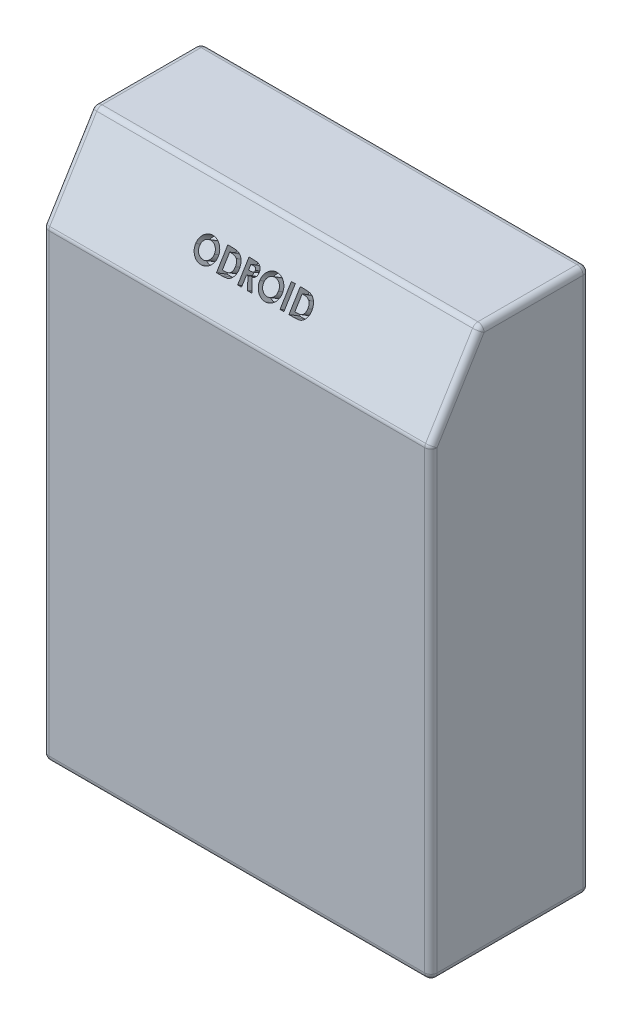
from build123d import *

# Parameters (mm, degrees)
SKETCH1_W           = 62.5
SKETCH1_H           = 87.5
BOSS_EXTRUDE1_DEPTH = 25.5
CUT_EXTRUDE1_DEPTH  = 65.5
FILLET1_R           = 1
SKETCH3_W           = 0.628205128
SKETCH3_H           = 3.5
CUT_EXTRUDE2_DEPTH  = 2


with BuildPart() as part:
    # Sketch1 → Boss-Extrude1 (new body)
    with BuildSketch(Plane.XY):
        Rectangle(SKETCH1_W, SKETCH1_H)
    extrude(amount=BOSS_EXTRUDE1_DEPTH)

    # Sketch2 → Cut-Extrude1 (cut)
    with BuildSketch(Plane(origin=(31.25, 0, 0), x_dir=(0, 0, -1), z_dir=(1, 0, 0))):
        Polygon((-25.5, 43.75), (-17.5, 43.75), (-25.5, 30.75), align=None)
    extrude(amount=-CUT_EXTRUDE1_DEPTH, mode=Mode.SUBTRACT)

    # Fillet1
    fillet1_edges = [part.edges().sort_by_distance(p)[0] for p in [
        (0, -43.75, 25.5),
        (-31.25, -6.5, 25.5),
        (0, 30.75, 25.5),
        (-31.25, 43.75, 8.75),
        (31.25, 43.75, 8.75),
        (-31.25, 37.25, 21.5),
        (0, 43.75, 17.5),
        (31.25, 37.25, 21.5),
        (31.25, -6.5, 25.5),
        (0, -43.75, 0),
        (-31.25, 0, 0),
        (0, 43.75, 0),
        (31.25, 0, 0),
        (31.25, -43.75, 12.75),
        (-31.25, -43.75, 12.75),
    ]]
    fillet(fillet1_edges, radius=FILLET1_R)

    # Sketch3 → Cut-Extrude2 (cut)
    # profile 1 of 6: a face of its own
    with BuildSketch(Plane(origin=(0, 19.82832618, 32.221030043), x_dir=(1, 0, 0), z_dir=(0, 0.5240974256643348, 0.8516583167045438))):
        with BuildLine():
            add(Edge.make_bspline(
                [(-8.513583921, 21.75241855), (-8.452732132, 21.750842988), (-8.332596917, 21.747732473), (-8.155921368, 21.721803895), (-7.985661809, 21.679556996), (-7.821895232, 21.62083075), (-7.665031688, 21.544034552), (-7.514517868, 21.451345625), (-7.370892905, 21.341014522), (-7.235628553, 21.215615084), (-7.110619896, 21.07924867), (-7.002299822, 20.932425982), (-6.909928436, 20.778951342), (-6.833370785, 20.618413512), (-6.775057883, 20.449700689), (-6.734137308, 20.273673087), (-6.707847866, 20.090380783), (-6.704824176, 19.965583707), (-6.703287447, 19.902158134)],
                knots=[0, 0, 0, 0, 1.014329547, 2.002516266, 2.970391464, 3.935626869, 4.897733899, 5.877609409, 6.878433252, 7.912639331, 8.949961323, 9.958554974, 10.949718813, 11.932905612, 12.9188844, 13.919928257, 14.942845884, 16, 16, 16, 16], degree=3))
            add(Edge.make_bspline(
                [(-6.703287447, 19.902158134), (-6.704923997, 19.83944722), (-6.708148871, 19.715873353), (-6.733064058, 19.53427016), (-6.774673741, 19.36012818), (-6.831997609, 19.193053239), (-6.907166795, 19.03385459), (-6.997736838, 18.881515772), (-7.10609771, 18.737450527), (-7.228297064, 18.601736164), (-7.362827949, 18.478546259), (-7.505317512, 18.369985367), (-7.655107825, 18.277994965), (-7.811979643, 18.202617187), (-7.976269369, 18.14411927), (-8.147571189, 18.102844739), (-8.325874501, 18.077761373), (-8.447129401, 18.074557563), (-8.508676069, 18.072931371)],
                knots=[0, 0, 0, 0, 1.051557043, 2.072126891, 3.067553643, 4.050577992, 5.02905126, 6.015227836, 7.017913613, 8.04756643, 9.074058332, 10.072836633, 11.047628519, 12.017157415, 12.98668631, 13.966869689, 14.968021931, 16, 16, 16, 16], degree=3))
            add(Edge.make_bspline(
                [(-8.508676069, 18.072931371), (-8.573046504, 18.074390146), (-8.699525611, 18.077256439), (-8.88462835, 18.104513578), (-9.061972768, 18.145572351), (-9.230069069, 18.206850368), (-9.390629173, 18.283453042), (-9.542473394, 18.377793827), (-9.685550706, 18.489716818), (-9.819040391, 18.616355626), (-9.93998237, 18.754926258), (-10.046737389, 18.901313843), (-10.136787615, 19.054400107), (-10.210136344, 19.2142567), (-10.267961536, 19.37989015), (-10.308750638, 19.552309213), (-10.332845734, 19.731100366), (-10.336202041, 19.852538891), (-10.337902832, 19.914077204)],
                knots=[0, 0, 0, 0, 1.067978421, 2.098431617, 3.099715153, 4.085208694, 5.062210972, 6.048429807, 7.046490867, 8.072918869, 9.098532598, 10.095778865, 11.076610158, 12.041847152, 13.011192615, 13.984257998, 14.978533688, 16, 16, 16, 16], degree=3))
            add(Edge.make_bspline(
                [(-10.337902832, 19.914077204), (-10.337369026, 19.95547696), (-10.336308173, 20.037752255), (-10.323529084, 20.159680042), (-10.30513087, 20.279227963), (-10.277920784, 20.395919378), (-10.244867484, 20.510577491), (-10.202042266, 20.622135035), (-10.153295577, 20.731783752), (-10.096339661, 20.838228553), (-10.03301019, 20.940490058), (-9.963912099, 21.03808588), (-9.888871641, 21.129835944), (-9.808130546, 21.216343193), (-9.721410571, 21.297039009), (-9.629852426, 21.373065753), (-9.531680417, 21.442403885), (-9.429043221, 21.506746781), (-9.322519483, 21.564930945), (-9.212542852, 21.614455566), (-9.101379062, 21.657704573), (-8.987543116, 21.691838602), (-8.872254968, 21.719640412), (-8.754282998, 21.738026226), (-8.634693016, 21.750804961), (-8.554049425, 21.751879411), (-8.513583921, 21.75241855)],
                knots=[0, 0, 0, 0, 1.034744296, 2.056386356, 3.06226378, 4.057406941, 5.050368692, 6.043467995, 7.042652155, 8.049140477, 9.059438543, 10.048523776, 11.036952808, 12.020949711, 13.004946614, 13.997082645, 14.994316842, 16.007702937, 17.024872941, 18.026463647, 19.021641123, 20.005082605, 20.995858141, 21.984425357, 22.988620895, 24, 24, 24, 24], degree=3))
        make_face()
        with BuildLine():
            add(Edge.make_bspline(
                [(-8.523399627, 21.124213422), (-8.564352873, 21.123114554), (-8.645178193, 21.12094583), (-8.763734218, 21.10442308), (-8.877552189, 21.07803437), (-8.986001167, 21.039810647), (-9.089551181, 20.991161549), (-9.188385792, 20.932257061), (-9.281136345, 20.861072408), (-9.369039579, 20.781429176), (-9.448445687, 20.692688313), (-9.518603488, 20.597587386), (-9.577314267, 20.496285212), (-9.626484912, 20.389722865), (-9.663499511, 20.276702079), (-9.689863899, 20.158108158), (-9.706525209, 20.033736759), (-9.708625387, 19.948952938), (-9.709697703, 19.905663743)],
                knots=[0, 0, 0, 0, 1.033739768, 2.040188636, 3.016340934, 3.979330865, 4.937572243, 5.900995986, 6.878200029, 7.884839167, 8.891893314, 9.879764717, 10.863503415, 11.843163062, 12.837761627, 13.859916423, 14.907309254, 16, 16, 16, 16], degree=3))
            add(Edge.make_bspline(
                [(-9.709697703, 19.905663743), (-9.708275976, 19.857689576), (-9.705489626, 19.763668159), (-9.685884529, 19.626512249), (-9.652342159, 19.496982104), (-9.603907629, 19.375711238), (-9.543836104, 19.261353028), (-9.469236805, 19.155309097), (-9.381317886, 19.056944503), (-9.313585863, 18.999515155), (-9.279208921, 18.970367268)],
                knots=[0, 0, 0, 0, 1.078454662, 2.113592447, 3.107694534, 4.079536787, 5.043276885, 6.005368276, 6.987637804, 8, 8, 8, 8], degree=3))
            add(Edge.make_bspline(
                [(-9.279208921, 18.970367268), (-9.251047643, 18.948833929), (-9.195359564, 18.9062524), (-9.106469266, 18.851675435), (-9.014929763, 18.804897531), (-8.920050274, 18.767101539), (-8.822031179, 18.737371846), (-8.72088592, 18.716552632), (-8.616757812, 18.703486774), (-8.546341505, 18.701925157), (-8.510779434, 18.701136499)],
                knots=[0, 0, 0, 0, 1.023928204, 2.024787132, 3.009472467, 3.9914905, 4.972207045, 5.96565515, 6.972602802, 8, 8, 8, 8], degree=3))
            add(Edge.make_bspline(
                [(-8.510779434, 18.701136499), (-8.47053038, 18.702244684), (-8.3913391, 18.704425072), (-8.274990059, 18.720744418), (-8.163524145, 18.748362643), (-8.056249366, 18.786251054), (-7.953475056, 18.835510984), (-7.855703501, 18.896242504), (-7.76276328, 18.96769991), (-7.674972033, 19.048389032), (-7.594726684, 19.137479473), (-7.524715288, 19.233087658), (-7.464137799, 19.333107054), (-7.415989658, 19.438953282), (-7.377512697, 19.549627205), (-7.351465617, 19.665618973), (-7.334663557, 19.786450424), (-7.332562787, 19.868680496), (-7.331492575, 19.910571595)],
                knots=[0, 0, 0, 0, 1.026359118, 2.019393844, 2.989460624, 3.950973911, 4.916101784, 5.890408035, 6.881132271, 7.902007068, 8.92769091, 9.933912415, 10.920395702, 11.90457117, 12.894218921, 13.903490204, 14.931958862, 16, 16, 16, 16], degree=3))
            add(Edge.make_bspline(
                [(-7.331492575, 19.910571595), (-7.332599816, 19.952221809), (-7.334779252, 20.034203903), (-7.35112732, 20.154724697), (-7.378570398, 20.270204395), (-7.416572584, 20.380831588), (-7.465099363, 20.486714731), (-7.525107649, 20.587481477), (-7.596386879, 20.683034409), (-7.677296567, 20.772722371), (-7.765361789, 20.855139862), (-7.859908604, 20.926663262), (-7.958291487, 20.988814823), (-8.06276782, 21.037501847), (-8.171200106, 21.076290695), (-8.284250003, 21.104855359), (-8.402345695, 21.120829757), (-8.482688637, 21.12307548), (-8.523399627, 21.124213422)],
                knots=[0, 0, 0, 0, 1.055025985, 2.07665775, 3.074803781, 4.057872707, 5.035505728, 6.020516407, 7.023567878, 8.050795229, 9.077271434, 10.074415901, 11.050397877, 12.019801805, 12.988065821, 13.964604439, 14.968634123, 16, 16, 16, 16], degree=3))
        make_face(mode=Mode.SUBTRACT)
    # profile 2 of 6: a face of its own
    with BuildSketch(Plane(origin=(0, 19.82832618, 32.221030043), x_dir=(1, 0, 0), z_dir=(0, 0.5240974256643348, 0.8516583167045438))):
        with BuildLine():
            Line((-6.075082319, 21.66267496), (-5.283515812, 21.66267496))
            add(Edge.make_bspline(
                [(-5.283515812, 21.66267496), (-5.221804099, 21.662243574), (-5.102514658, 21.6614097), (-4.929687858, 21.652013946), (-4.768980927, 21.637563942), (-4.62029027, 21.617685343), (-4.483920726, 21.591380513), (-4.360048141, 21.558386259), (-4.24825677, 21.520299882), (-4.147320843, 21.475483531), (-4.05517605, 21.423232117), (-3.967681628, 21.365028236), (-3.88500937, 21.298739711), (-3.805999103, 21.225645379), (-3.73167047, 21.144408001), (-3.660785633, 21.056373164), (-3.595080176, 20.960264241), (-3.532567963, 20.85838562), (-3.476033984, 20.750305549), (-3.426722936, 20.636943985), (-3.385414771, 20.519030449), (-3.351849749, 20.396439278), (-3.325094552, 20.269577437), (-3.30637448, 20.138188931), (-3.294801545, 20.002395402), (-3.293627568, 19.910361461), (-3.293031037, 19.863596435)],
                knots=[0, 0, 0, 0, 1.44355588, 2.790409838, 4.047694926, 5.217575253, 6.298404546, 7.294384826, 8.214239204, 9.058592145, 9.873746385, 10.689560431, 11.514393297, 12.350027578, 13.205127629, 14.088021785, 14.991911688, 15.926770944, 16.882954281, 17.842803888, 18.816321264, 19.80318086, 20.814351908, 21.847355356, 22.906180909, 24, 24, 24, 24], degree=3))
            add(Edge.make_bspline(
                [(-3.293031037, 19.863596435), (-3.294593077, 19.797607939), (-3.297668044, 19.667705723), (-3.323569847, 19.477075718), (-3.365461834, 19.294337844), (-3.424365772, 19.12092155), (-3.497390887, 18.958371131), (-3.584627564, 18.809553097), (-3.684796711, 18.675266228), (-3.79673135, 18.556179162), (-3.917929303, 18.453822214), (-4.043878416, 18.36616098), (-4.175805663, 18.297032781), (-4.292052004, 18.253195166), (-4.392852085, 18.225931962), (-4.481353465, 18.209819146), (-4.581882003, 18.195042722), (-4.69537504, 18.183623819), (-4.821334707, 18.173440964), (-4.960263079, 18.167907997), (-5.111710348, 18.163310922), (-5.216904796, 18.162892502), (-5.271596742, 18.16267496)],
                knots=[0, 0, 0, 0, 1.315458931, 2.589557908, 3.828601765, 5.048913369, 6.235739168, 7.376350998, 8.481830359, 9.569842114, 10.627874879, 11.640079404, 12.624025415, 13.590060155, 14.111227486, 14.704434459, 15.382649715, 16.137166398, 16.978595427, 17.902333227, 18.909396075, 20, 20, 20, 20], degree=3))
            Line((-5.271596742, 18.16267496), (-6.075082319, 18.16267496))
            Line((-6.075082319, 18.16267496), (-6.075082319, 21.66267496))
        make_face()
        with BuildLine():
            Line((-5.446877191, 21.034469832), (-5.446877191, 18.790880089))
            Line((-5.446877191, 18.790880089), (-5.118752191, 18.790880089))
            add(Edge.make_bspline(
                [(-5.118752191, 18.790880089), (-5.079710355, 18.790951629), (-5.004619908, 18.791089226), (-4.896206299, 18.79764308), (-4.795951201, 18.804221342), (-4.70413059, 18.816707103), (-4.620076227, 18.830615362), (-4.544942797, 18.849970609), (-4.477181474, 18.870301657), (-4.41761995, 18.8961856), (-4.363066447, 18.925319701), (-4.312556135, 18.959453677), (-4.263799541, 18.997358171), (-4.217708211, 19.040148007), (-4.174107699, 19.087256567), (-4.133255973, 19.138926581), (-4.094607772, 19.195000402), (-4.059155121, 19.255774507), (-4.026758299, 19.320607106), (-3.998018687, 19.388870203), (-3.974189308, 19.461132281), (-3.954383787, 19.53671688), (-3.940230497, 19.61628205), (-3.928521349, 19.699238463), (-3.922484942, 19.785914786), (-3.921656483, 19.844892253), (-3.921236165, 19.874814384)],
                knots=[0, 0, 0, 0, 1.50275155, 2.890291501, 4.180787663, 5.369391935, 6.45668281, 7.458360028, 8.354766181, 9.177074746, 9.954075863, 10.732690366, 11.5210699, 12.329727389, 13.151100085, 13.990027547, 14.863562427, 15.770965086, 16.696477834, 17.652329173, 18.619756807, 19.62365428, 20.657822005, 21.729286259, 22.847956731, 24, 24, 24, 24], degree=3))
            add(Edge.make_bspline(
                [(-3.921236165, 19.874814384), (-3.922073295, 19.92066722), (-3.923705633, 20.010076699), (-3.939447552, 20.140303557), (-3.965072394, 20.262931652), (-4.001636574, 20.377505879), (-4.047726855, 20.484348252), (-4.105419587, 20.582553589), (-4.172231895, 20.673771606), (-4.225065246, 20.727283021), (-4.25146453, 20.754021114)],
                knots=[0, 0, 0, 0, 1.13821349, 2.219428113, 3.251817212, 4.244760574, 5.201143372, 6.134805572, 7.068016741, 8, 8, 8, 8], degree=3))
            add(Edge.make_bspline(
                [(-4.25146453, 20.754021114), (-4.277496725, 20.776805585), (-4.330664533, 20.823340285), (-4.424009734, 20.879100757), (-4.526871311, 20.928091798), (-4.641602428, 20.966936229), (-4.76709426, 20.997656061), (-4.904094239, 21.018842778), (-5.051868701, 21.032457138), (-5.154243405, 21.033784561), (-5.207093537, 21.034469832)],
                knots=[0, 0, 0, 0, 0.813307809, 1.661089106, 2.549956539, 3.493439533, 4.508053171, 5.589449661, 6.755572447, 8, 8, 8, 8], degree=3))
            Line((-5.207093537, 21.034469832), (-5.446877191, 21.034469832))
        make_face(mode=Mode.SUBTRACT)
    # profile 3 of 6: a face of its own
    with BuildSketch(Plane(origin=(0, 19.82832618, 32.221030043), x_dir=(1, 0, 0), z_dir=(0, 0.5240974256643348, 0.8516583167045438))):
        with BuildLine():
            Line((-2.664825909, 21.66267496), (-1.932854755, 21.66267496))
            add(Edge.make_bspline(
                [(-1.932854755, 21.66267496), (-1.884471684, 21.662503228), (-1.791417411, 21.662172939), (-1.657238231, 21.656961849), (-1.533976202, 21.64971019), (-1.421448823, 21.638643966), (-1.319704235, 21.623971491), (-1.228640466, 21.60667507), (-1.148260178, 21.58696209), (-1.077885474, 21.562398162), (-1.014375783, 21.534690424), (-0.955175922, 21.502853724), (-0.898979853, 21.467242575), (-0.846163187, 21.426919952), (-0.796266934, 21.382611247), (-0.749196962, 21.33427186), (-0.705618413, 21.281491892), (-0.665801128, 21.224604847), (-0.629510877, 21.164760981), (-0.597437907, 21.101878126), (-0.571356115, 21.035912553), (-0.548310055, 20.967817606), (-0.531710725, 20.896619855), (-0.520166134, 20.823012422), (-0.511713636, 20.746736201), (-0.511227657, 20.694917523), (-0.510979755, 20.668484255)],
                knots=[0, 0, 0, 0, 1.749336639, 3.364467119, 4.854658419, 6.213483162, 7.451590619, 8.570285859, 9.5643256, 10.440900261, 11.26203566, 12.067320669, 12.869050712, 13.665104639, 14.467235401, 15.27997916, 16.102287765, 16.939272006, 17.78853747, 18.631303466, 19.488103222, 20.351255419, 21.228522269, 22.127379805, 23.044756219, 24, 24, 24, 24], degree=3))
            add(Edge.make_bspline(
                [(-0.510979755, 20.668484255), (-0.511623717, 20.640893997), (-0.512886409, 20.586794528), (-0.519687958, 20.507326821), (-0.532119052, 20.431297678), (-0.550947753, 20.358929702), (-0.572588898, 20.289322189), (-0.601366071, 20.223759443), (-0.633843954, 20.161287947), (-0.672416987, 20.102791384), (-0.714749007, 20.04697043), (-0.763980255, 19.995963791), (-0.816921303, 19.947030055), (-0.876548161, 19.903234264), (-0.94023242, 19.861615105), (-1.00923942, 19.823897064), (-1.083118799, 19.789131995), (-1.13505966, 19.769744591), (-1.16162078, 19.759830409)],
                knots=[0, 0, 0, 0, 1.099860209, 2.156625411, 3.176576793, 4.16617041, 5.135385252, 6.078461593, 7.016046972, 7.938469504, 8.868247731, 9.803980173, 10.76021508, 11.73834243, 12.748633912, 13.790971185, 14.870363756, 16, 16, 16, 16], degree=3))
            Line((-1.16162078, 19.759830409), (-0.353928473, 18.16267496))
            Line((-0.353928473, 18.16267496), (-1.05224578, 18.16267496))
            Line((-1.05224578, 18.16267496), (-1.823479755, 19.688315986))
            Line((-1.823479755, 19.688315986), (-2.03662078, 19.688315986))
            Line((-2.03662078, 19.688315986), (-2.03662078, 18.16267496))
            Line((-2.03662078, 18.16267496), (-2.664825909, 18.16267496))
            Line((-2.664825909, 18.16267496), (-2.664825909, 21.66267496))
        make_face()
        with BuildLine():
            Line((-2.03662078, 20.316521114), (-1.791929274, 20.316521114))
            add(Edge.make_bspline(
                [(-1.791929274, 20.316521114), (-1.762013703, 20.316858044), (-1.704731814, 20.317503191), (-1.622352933, 20.320495651), (-1.547533262, 20.327706), (-1.479951502, 20.336816007), (-1.419267586, 20.347334826), (-1.366022794, 20.362408933), (-1.319396704, 20.378561219), (-1.279941838, 20.398634321), (-1.246232508, 20.421461792), (-1.217126658, 20.447394366), (-1.193051947, 20.477408018), (-1.173237232, 20.510687108), (-1.157823538, 20.547525979), (-1.146572722, 20.587520225), (-1.14028518, 20.631125432), (-1.139561777, 20.661218962), (-1.139184883, 20.676897717)],
                knots=[0, 0, 0, 0, 1.688639943, 3.233382647, 4.650958383, 5.928841754, 7.082724185, 8.122798841, 9.049171256, 9.863274652, 10.613301712, 11.341792392, 12.054588806, 12.776240173, 13.521029143, 14.301969904, 15.115324896, 16, 16, 16, 16], degree=3))
            add(Edge.make_bspline(
                [(-1.139184883, 20.676897717), (-1.139897435, 20.695446828), (-1.141297111, 20.73188312), (-1.155186249, 20.784338603), (-1.177294755, 20.832889742), (-1.207599463, 20.87731717), (-1.245764302, 20.916265321), (-1.289561465, 20.950598426), (-1.339936203, 20.977746476), (-1.386579418, 20.995653041), (-1.429013842, 21.006366724), (-1.467309571, 21.014350465), (-1.511656256, 21.020008772), (-1.562087375, 21.026010414), (-1.61847438, 21.029902174), (-1.681124611, 21.032742384), (-1.749858139, 21.033904453), (-1.797771935, 21.034275946), (-1.822778633, 21.034469832)],
                knots=[0, 0, 0, 0, 1.020303359, 2.004196876, 2.966617323, 3.9489082, 4.950758222, 5.960522915, 7.003732012, 8.091992268, 8.70421221, 9.413913587, 10.24622431, 11.166358409, 12.212345909, 13.359657661, 14.621978493, 16, 16, 16, 16], degree=3))
            Line((-1.822778633, 21.034469832), (-2.03662078, 21.034469832))
            Line((-2.03662078, 21.034469832), (-2.03662078, 20.316521114))
        make_face(mode=Mode.SUBTRACT)
    # profile 4 of 6: a face of its own
    with BuildSketch(Plane(origin=(0, 19.82832618, 32.221030043), x_dir=(1, 0, 0), z_dir=(0, 0.5240974256643348, 0.8516583167045438))):
        with BuildLine():
            add(Edge.make_bspline(
                [(1.806928899, 21.75241855), (1.867780689, 21.750842988), (1.987915904, 21.747732473), (2.164591453, 21.721803895), (2.334851011, 21.679556996), (2.498617589, 21.62083075), (2.655481133, 21.544034552), (2.805994952, 21.451345625), (2.949619915, 21.341014522), (3.084884268, 21.215615084), (3.209892925, 21.07924867), (3.318212999, 20.932425982), (3.410584384, 20.778951342), (3.487142036, 20.618413512), (3.545454937, 20.449700689), (3.586375512, 20.273673087), (3.612664954, 20.090380783), (3.615688644, 19.965583707), (3.617225373, 19.902158134)],
                knots=[0, 0, 0, 0, 1.014329547, 2.002516266, 2.970391464, 3.935626869, 4.897733899, 5.877609409, 6.878433252, 7.912639331, 8.949961323, 9.958554974, 10.949718813, 11.932905612, 12.9188844, 13.919928257, 14.942845884, 16, 16, 16, 16], degree=3))
            add(Edge.make_bspline(
                [(3.617225373, 19.902158134), (3.615588824, 19.83944722), (3.612363949, 19.715873353), (3.587448762, 19.53427016), (3.54583908, 19.36012818), (3.488515211, 19.193053239), (3.413346026, 19.03385459), (3.322775983, 18.881515772), (3.214415111, 18.737450527), (3.092215756, 18.601736164), (2.957684872, 18.478546259), (2.815195309, 18.369985367), (2.665404996, 18.277994965), (2.508533178, 18.202617187), (2.344243451, 18.14411927), (2.172941632, 18.102844739), (1.994638319, 18.077761373), (1.87338342, 18.074557563), (1.811836752, 18.072931371)],
                knots=[0, 0, 0, 0, 1.051557043, 2.072126891, 3.067553643, 4.050577992, 5.02905126, 6.015227836, 7.017913613, 8.04756643, 9.074058332, 10.072836633, 11.047628519, 12.017157415, 12.98668631, 13.966869689, 14.968021931, 16, 16, 16, 16], degree=3))
            add(Edge.make_bspline(
                [(1.811836752, 18.072931371), (1.747466316, 18.074390146), (1.62098721, 18.077256439), (1.435884471, 18.104513578), (1.258540053, 18.145572351), (1.090443751, 18.206850368), (0.929883648, 18.283453042), (0.778039426, 18.377793827), (0.634962115, 18.489716818), (0.501472429, 18.616355626), (0.380530451, 18.754926258), (0.273775432, 18.901313843), (0.183725205, 19.054400107), (0.110376476, 19.2142567), (0.052551285, 19.37989015), (0.011762182, 19.552309213), (-0.012332914, 19.731100366), (-0.015689221, 19.852538891), (-0.017390011, 19.914077204)],
                knots=[0, 0, 0, 0, 1.067978421, 2.098431617, 3.099715153, 4.085208694, 5.062210972, 6.048429807, 7.046490867, 8.072918869, 9.098532598, 10.095778865, 11.076610158, 12.041847152, 13.011192615, 13.984257998, 14.978533688, 16, 16, 16, 16], degree=3))
            add(Edge.make_bspline(
                [(-0.017390011, 19.914077204), (-0.016856205, 19.95547696), (-0.015795352, 20.037752255), (-0.003016263, 20.159680042), (0.015381951, 20.279227963), (0.042592037, 20.395919378), (0.075645336, 20.510577491), (0.118470555, 20.622135035), (0.167217243, 20.731783752), (0.224173159, 20.838228553), (0.28750263, 20.940490058), (0.356600722, 21.03808588), (0.43164118, 21.129835944), (0.512382274, 21.216343193), (0.59910225, 21.297039009), (0.690660394, 21.373065753), (0.788832403, 21.442403885), (0.891469599, 21.506746781), (0.997993337, 21.564930945), (1.107969969, 21.614455566), (1.219133759, 21.657704573), (1.332969705, 21.691838602), (1.448257853, 21.719640412), (1.566229822, 21.738026226), (1.685819804, 21.750804961), (1.766463396, 21.751879411), (1.806928899, 21.75241855)],
                knots=[0, 0, 0, 0, 1.034744296, 2.056386356, 3.06226378, 4.057406941, 5.050368692, 6.043467995, 7.042652155, 8.049140477, 9.059438543, 10.048523776, 11.036952808, 12.020949711, 13.004946614, 13.997082645, 14.994316842, 16.007702937, 17.024872941, 18.026463647, 19.021641123, 20.005082605, 20.995858141, 21.984425357, 22.988620895, 24, 24, 24, 24], degree=3))
        make_face()
        with BuildLine():
            add(Edge.make_bspline(
                [(1.797113194, 21.124213422), (1.756159948, 21.123114554), (1.675334628, 21.12094583), (1.556778603, 21.10442308), (1.442960632, 21.07803437), (1.334511653, 21.039810647), (1.230961639, 20.991161549), (1.132127028, 20.932257061), (1.039376475, 20.861072408), (0.951473241, 20.781429176), (0.872067134, 20.692688313), (0.801909333, 20.597587386), (0.743198553, 20.496285212), (0.694027908, 20.389722865), (0.65701331, 20.276702079), (0.630648921, 20.158108158), (0.613987612, 20.033736759), (0.611887433, 19.948952938), (0.610815117, 19.905663743)],
                knots=[0, 0, 0, 0, 1.033739768, 2.040188636, 3.016340934, 3.979330865, 4.937572243, 5.900995986, 6.878200029, 7.884839167, 8.891893314, 9.879764717, 10.863503415, 11.843163062, 12.837761627, 13.859916423, 14.907309254, 16, 16, 16, 16], degree=3))
            add(Edge.make_bspline(
                [(0.610815117, 19.905663743), (0.612236844, 19.857689576), (0.615023194, 19.763668159), (0.634628292, 19.626512249), (0.668170662, 19.496982104), (0.716605192, 19.375711238), (0.776676716, 19.261353028), (0.851276016, 19.155309097), (0.939194934, 19.056944503), (1.006926957, 18.999515155), (1.041303899, 18.970367268)],
                knots=[0, 0, 0, 0, 1.078454662, 2.113592447, 3.107694534, 4.079536787, 5.043276885, 6.005368276, 6.987637804, 8, 8, 8, 8], degree=3))
            add(Edge.make_bspline(
                [(1.041303899, 18.970367268), (1.069465178, 18.948833929), (1.125153256, 18.9062524), (1.214043554, 18.851675435), (1.305583058, 18.804897531), (1.400462547, 18.767101539), (1.498481642, 18.737371846), (1.5996269, 18.716552632), (1.703755008, 18.703486774), (1.774171315, 18.701925157), (1.809733386, 18.701136499)],
                knots=[0, 0, 0, 0, 1.023928204, 2.024787132, 3.009472467, 3.9914905, 4.972207045, 5.96565515, 6.972602802, 8, 8, 8, 8], degree=3))
            add(Edge.make_bspline(
                [(1.809733386, 18.701136499), (1.84998244, 18.702244684), (1.92917372, 18.704425072), (2.045522761, 18.720744418), (2.156988676, 18.748362643), (2.264263454, 18.786251054), (2.367037764, 18.835510984), (2.46480932, 18.896242504), (2.557749541, 18.96769991), (2.645540787, 19.048389032), (2.725786137, 19.137479473), (2.795797533, 19.233087658), (2.856375022, 19.333107054), (2.904523163, 19.438953282), (2.943000124, 19.549627205), (2.969047203, 19.665618973), (2.985849263, 19.786450424), (2.987950034, 19.868680496), (2.989020245, 19.910571595)],
                knots=[0, 0, 0, 0, 1.026359118, 2.019393844, 2.989460624, 3.950973911, 4.916101784, 5.890408035, 6.881132271, 7.902007068, 8.92769091, 9.933912415, 10.920395702, 11.90457117, 12.894218921, 13.903490204, 14.931958862, 16, 16, 16, 16], degree=3))
            add(Edge.make_bspline(
                [(2.989020245, 19.910571595), (2.987913004, 19.952221809), (2.985733569, 20.034203903), (2.9693855, 20.154724697), (2.941942423, 20.270204395), (2.903940236, 20.380831588), (2.855413457, 20.486714731), (2.795405172, 20.587481477), (2.724125941, 20.683034409), (2.643216254, 20.772722371), (2.555151032, 20.855139862), (2.460604216, 20.926663262), (2.362221333, 20.988814823), (2.257745, 21.037501847), (2.149312715, 21.076290695), (2.036262818, 21.104855359), (1.918167125, 21.120829757), (1.837824184, 21.12307548), (1.797113194, 21.124213422)],
                knots=[0, 0, 0, 0, 1.055025985, 2.07665775, 3.074803781, 4.057872707, 5.035505728, 6.020516407, 7.023567878, 8.050795229, 9.077271434, 10.074415901, 11.050397877, 12.019801805, 12.988065821, 13.964604439, 14.968634123, 16, 16, 16, 16], degree=3))
        make_face(mode=Mode.SUBTRACT)
    # profile 5 of 6: a face of its own
    with BuildSketch(Plane(origin=(0, 19.82832618, 32.221030043), x_dir=(1, 0, 0), z_dir=(0, 0.5240974256643348, 0.8516583167045438))):
        with Locations((4.469789476, 19.91267496)):
            Rectangle(SKETCH3_W, SKETCH3_H)
    # profile 6 of 6: a face of its own
    with BuildSketch(Plane(origin=(0, 19.82832618, 32.221030043), x_dir=(1, 0, 0), z_dir=(0, 0.5240974256643348, 0.8516583167045438))):
        with BuildLine():
            Line((5.591584348, 21.66267496), (6.383150854, 21.66267496))
            add(Edge.make_bspline(
                [(6.383150854, 21.66267496), (6.444862568, 21.662243574), (6.564152009, 21.6614097), (6.736978808, 21.652013946), (6.89768574, 21.637563942), (7.046376397, 21.617685343), (7.182745941, 21.591380513), (7.306618525, 21.558386259), (7.418409897, 21.520299882), (7.519345824, 21.475483531), (7.611490617, 21.423232117), (7.698985039, 21.365028236), (7.781657296, 21.298739711), (7.860667564, 21.225645379), (7.934996197, 21.144408001), (8.005881033, 21.056373164), (8.071586491, 20.960264241), (8.134098704, 20.85838562), (8.190632683, 20.750305549), (8.239943731, 20.636943985), (8.281251895, 20.519030449), (8.314816918, 20.396439278), (8.341572115, 20.269577437), (8.360292187, 20.138188931), (8.371865122, 20.002395402), (8.373039099, 19.910361461), (8.37363563, 19.863596435)],
                knots=[0, 0, 0, 0, 1.44355588, 2.790409838, 4.047694926, 5.217575253, 6.298404546, 7.294384826, 8.214239204, 9.058592145, 9.873746385, 10.689560431, 11.514393297, 12.350027578, 13.205127629, 14.088021785, 14.991911688, 15.926770944, 16.882954281, 17.842803888, 18.816321264, 19.80318086, 20.814351908, 21.847355356, 22.906180909, 24, 24, 24, 24], degree=3))
            add(Edge.make_bspline(
                [(8.37363563, 19.863596435), (8.37207359, 19.797607939), (8.368998623, 19.667705723), (8.34309682, 19.477075718), (8.301204833, 19.294337844), (8.242300895, 19.12092155), (8.16927578, 18.958371131), (8.082039102, 18.809553097), (7.981869956, 18.675266228), (7.869935316, 18.556179162), (7.748737363, 18.453822214), (7.622788251, 18.36616098), (7.490861004, 18.297032781), (7.374614662, 18.253195166), (7.273814582, 18.225931962), (7.185313201, 18.209819146), (7.084784664, 18.195042722), (6.971291627, 18.183623819), (6.84533196, 18.173440964), (6.706403587, 18.167907997), (6.554956318, 18.163310922), (6.449761871, 18.162892502), (6.395069925, 18.16267496)],
                knots=[0, 0, 0, 0, 1.315458931, 2.589557908, 3.828601765, 5.048913369, 6.235739168, 7.376350998, 8.481830359, 9.569842114, 10.627874879, 11.640079404, 12.624025415, 13.590060155, 14.111227486, 14.704434459, 15.382649715, 16.137166398, 16.978595427, 17.902333227, 18.909396075, 20, 20, 20, 20], degree=3))
            Line((6.395069925, 18.16267496), (5.591584348, 18.16267496))
            Line((5.591584348, 18.16267496), (5.591584348, 21.66267496))
        make_face()
        with BuildLine():
            Line((6.219789476, 21.034469832), (6.219789476, 18.790880089))
            Line((6.219789476, 18.790880089), (6.547914476, 18.790880089))
            add(Edge.make_bspline(
                [(6.547914476, 18.790880089), (6.586956312, 18.790951629), (6.662046759, 18.791089226), (6.770460368, 18.79764308), (6.870715466, 18.804221342), (6.962536076, 18.816707103), (7.04659044, 18.830615362), (7.121723869, 18.849970609), (7.189485192, 18.870301657), (7.249046716, 18.8961856), (7.30360022, 18.925319701), (7.354110532, 18.959453677), (7.402867126, 18.997358171), (7.448958456, 19.040148007), (7.492558968, 19.087256567), (7.533410694, 19.138926581), (7.572058895, 19.195000402), (7.607511546, 19.255774507), (7.639908368, 19.320607106), (7.66864798, 19.388870203), (7.692477358, 19.461132281), (7.712282879, 19.53671688), (7.726436169, 19.61628205), (7.738145318, 19.699238463), (7.744181725, 19.785914786), (7.745010184, 19.844892253), (7.745430502, 19.874814384)],
                knots=[0, 0, 0, 0, 1.50275155, 2.890291501, 4.180787663, 5.369391935, 6.45668281, 7.458360028, 8.354766181, 9.177074746, 9.954075863, 10.732690366, 11.5210699, 12.329727389, 13.151100085, 13.990027547, 14.863562427, 15.770965086, 16.696477834, 17.652329173, 18.619756807, 19.62365428, 20.657822005, 21.729286259, 22.847956731, 24, 24, 24, 24], degree=3))
            add(Edge.make_bspline(
                [(7.745430502, 19.874814384), (7.744593372, 19.92066722), (7.742961033, 20.010076699), (7.727219114, 20.140303557), (7.701594273, 20.262931652), (7.665030093, 20.377505879), (7.618939811, 20.484348252), (7.56124708, 20.582553589), (7.494434771, 20.673771606), (7.441601421, 20.727283021), (7.415202136, 20.754021114)],
                knots=[0, 0, 0, 0, 1.13821349, 2.219428113, 3.251817212, 4.244760574, 5.201143372, 6.134805572, 7.068016741, 8, 8, 8, 8], degree=3))
            add(Edge.make_bspline(
                [(7.415202136, 20.754021114), (7.389169942, 20.776805585), (7.336002133, 20.823340285), (7.242656933, 20.879100757), (7.139795356, 20.928091798), (7.025064239, 20.966936229), (6.899572407, 20.997656061), (6.762572427, 21.018842778), (6.614797965, 21.032457138), (6.512423261, 21.033784561), (6.45957313, 21.034469832)],
                knots=[0, 0, 0, 0, 0.813307809, 1.661089106, 2.549956539, 3.493439533, 4.508053171, 5.589449661, 6.755572447, 8, 8, 8, 8], degree=3))
            Line((6.45957313, 21.034469832), (6.219789476, 21.034469832))
        make_face(mode=Mode.SUBTRACT)
    extrude(amount=-CUT_EXTRUDE2_DEPTH, mode=Mode.SUBTRACT)


solid = part.part
